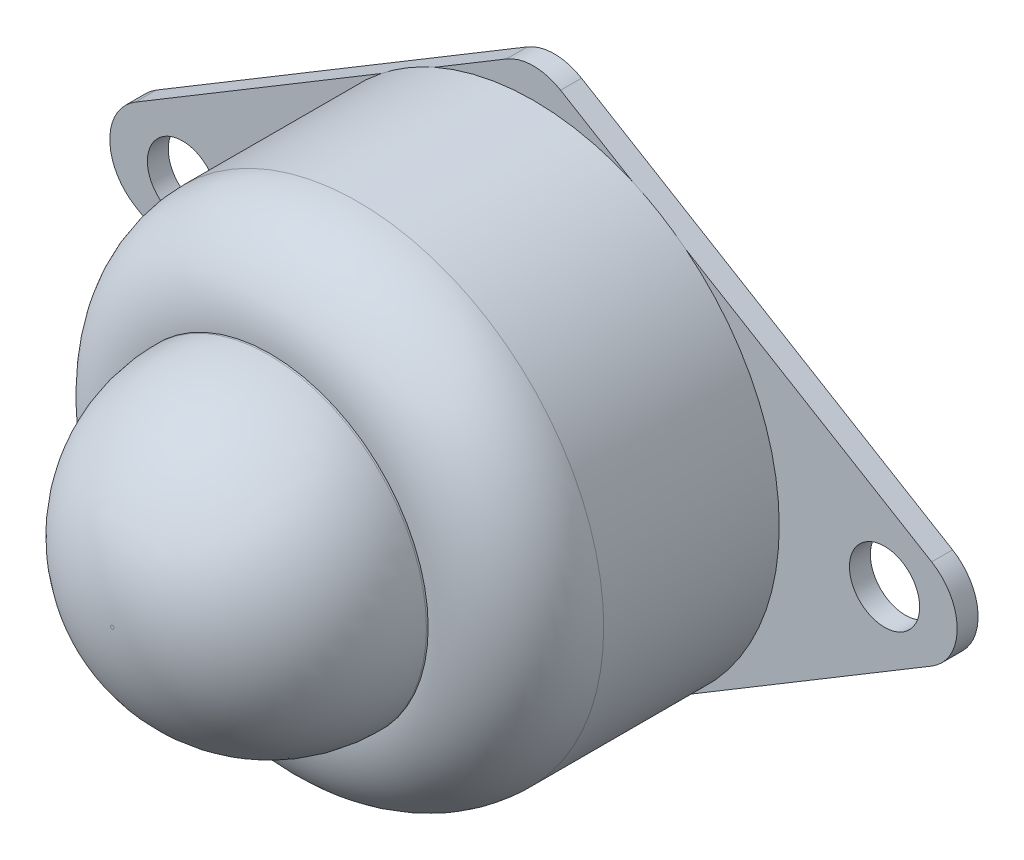
from build123d import *

# Parameters (mm, degrees)
ESQUISSE1_R        = 2
BOSS_EXTRU_1_DEPTH = 1.19
ESQUISSE2_R        = 14
BOSS_EXTRU_2_DEPTH = 15
CONG_1_R           = 5
ESQUISSE3_R        = 9
BOSS_EXTRU_3_DEPTH = 9
CONG_2_R           = 8.9


with BuildPart() as part:
    # Esquisse1 → Boss.-Extru.1 (new body)
    with BuildSketch(Plane.XY):
        with BuildLine():
            Line((1.31508183, 18.266068418), (22.45508183, 30.966068418))
            ThreePointArc((22.45508183, 30.966068418), (24, 31.394448725), (25.54491817, 30.966068418))
            Line((25.54491817, 30.966068418), (46.68491817, 18.266068418))
            ThreePointArc((46.68491817, 18.266068418), (48.14, 15.694448725), (46.68491817, 13.122829031))
            Line((46.68491817, 13.122829031), (25.54491817, 0.422829031))
            ThreePointArc((25.54491817, 0.422829031), (24, -0.005551275), (22.45508183, 0.422829031))
            Line((22.45508183, 0.422829031), (1.31508183, 13.122829031))
            ThreePointArc((1.31508183, 13.122829031), (-0.14, 15.694448725), (1.31508183, 18.266068418))
        make_face()
        with Locations((44, 15.694448725)):
            Circle(ESQUISSE1_R, mode=Mode.SUBTRACT)
        with Locations(Location((4, 15.694448725, 0), (0, 0, 180))):
            Circle(ESQUISSE1_R, mode=Mode.SUBTRACT)
    extrude(amount=BOSS_EXTRU_1_DEPTH)

    # Esquisse2 → Boss.-Extru.2 (add)
    with BuildSketch(Plane.XY.offset(1.19)):
        with Locations(Location((24, 15.694448725, 0), (0, 0, 231.704406007))):
            Circle(ESQUISSE2_R)
    extrude(amount=BOSS_EXTRU_2_DEPTH)

    # Congé1
    cong_1_edges = [part.edges().sort_by_distance(p)[0] for p in [
        (32.676061537, 26.681985128, 16.19),
    ]]
    fillet(cong_1_edges, radius=CONG_1_R)

    # Esquisse3 → Boss.-Extru.3 (add)
    with BuildSketch(Plane.XY.offset(16.19)):
        with Locations((24, 15.694448725)):
            Circle(ESQUISSE3_R)
    extrude(amount=BOSS_EXTRU_3_DEPTH)

    # Congé2
    cong_2_edges = [part.edges().sort_by_distance(p)[0] for p in [
        (15, 15.694448725, 25.19),
    ]]
    fillet(cong_2_edges, radius=CONG_2_R)


solid = part.part
